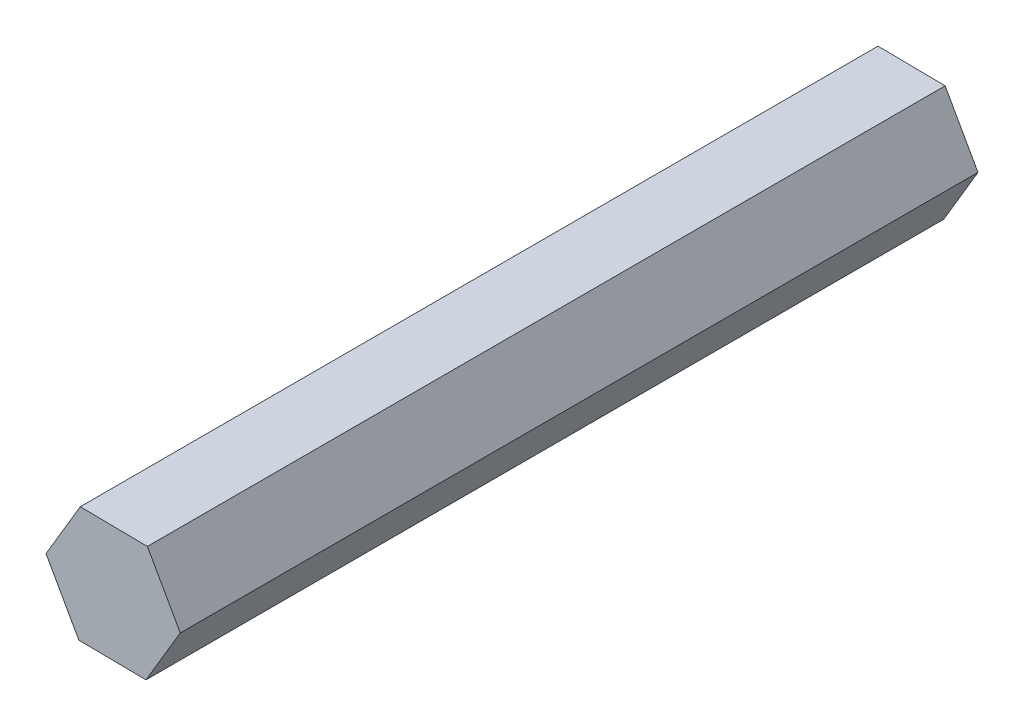
from build123d import *

# Parameters (mm, degrees)
BOSS_EXTRUDE1_DEPTH = 65.3542


with BuildPart() as part:
    # Sketch1 → Boss-Extrude1 (new body)
    with BuildSketch(Plane.XY):
        Polygon((2.806881074, 4.728984419), (-2.691980104, 4.795322525), (-5.498861178, 0.066338106), (-2.806881074, -4.728984419), (2.691980104, -4.795322525), (5.498861178, -0.066338106), align=None)
    extrude(amount=BOSS_EXTRUDE1_DEPTH)


solid = part.part
